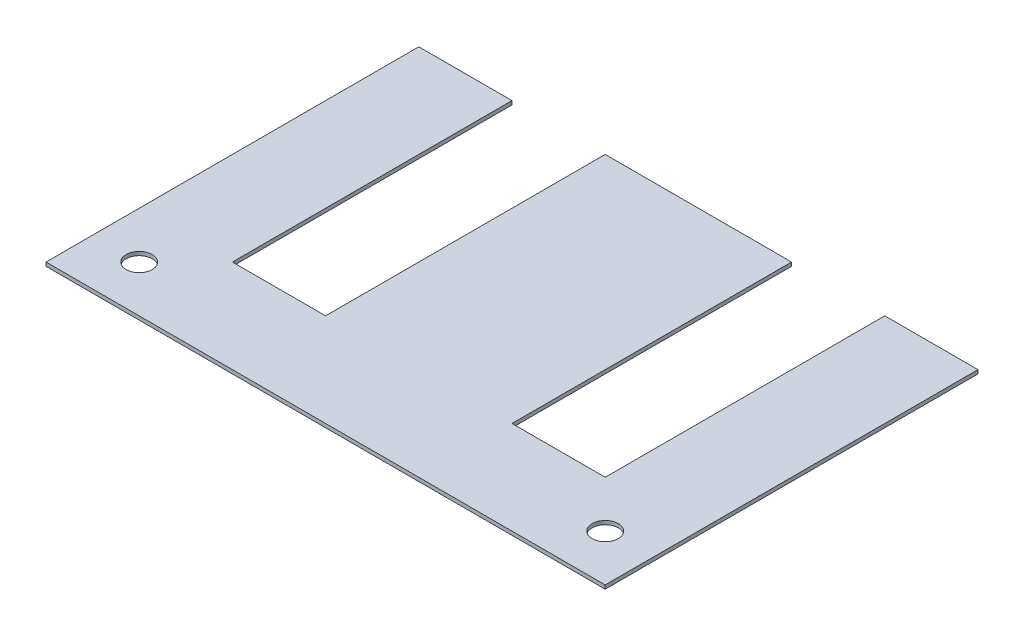
from build123d import *

# Parameters (mm, degrees)
CROQUIS8_R              = 3.5
SALIENTE_EXTRUIR5_DEPTH = 1


with BuildPart() as part:
    # Croquis8 → Saliente-Extruir5 (new body)
    with BuildSketch(Plane(origin=(0, 0, 0), x_dir=(1, 0, 0), z_dir=(0, 1, 0))):
        Polygon((0, 0), (150, 0), (150, 100), (125, 100), (125, 25), (100, 25), (100, 100), (50, 100), (50, 25), (25, 25), (25, 100), (0, 100), align=None)
        with Locations(Location((12.5, 12.5, 0), (0, 0, 270))):
            Circle(CROQUIS8_R, mode=Mode.SUBTRACT)
        with Locations(Location((137.5, 12.5, 0), (0, 0, 270))):
            Circle(CROQUIS8_R, mode=Mode.SUBTRACT)
    extrude(amount=SALIENTE_EXTRUIR5_DEPTH)


solid = part.part
